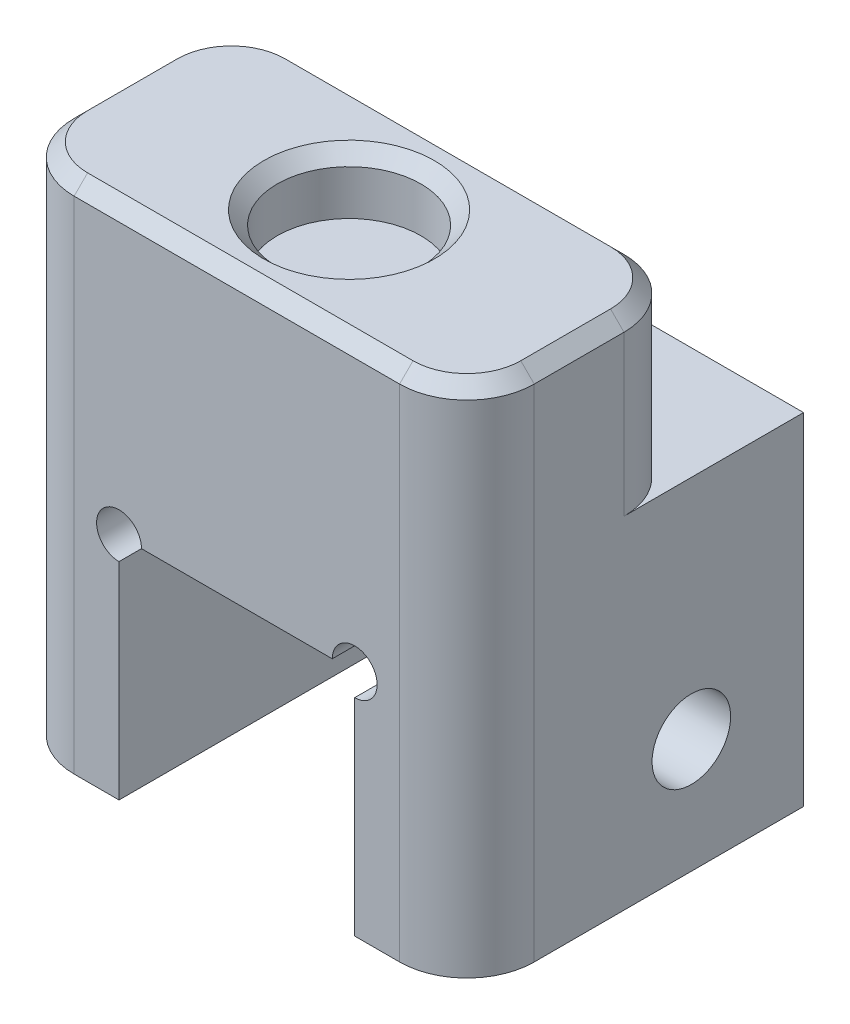
from build123d import *

# Parameters (mm, degrees)
EXTRUDE_1_DEPTH     = 10
EXTRUDE_2_DEPTH     = 5
SKETCH_2_R          = 3.2
CUT_EXTRUDE_1_DEPTH = 2.6
SKETCH_4_R          = 1
CUT_EXTRUDE_3_DEPTH = 22.474752618
SKETCH_6_R          = 1.75
CUT_EXTRUDE_4_DEPTH = 26.521608492
FILLET_1_R          = 3
CHAMFER_1_SIZE      = 0.6


with BuildPart() as part:
    # ｽｹｯﾁ1 → ﾎﾞｽ - 押し出し1 (new body)
    with BuildSketch(Plane.XY):
        Polygon((-10.25, 11.45), (-10.25, -11.45), (-5.25, -11.45), (-5.25, -1.25), (5.25, -1.25), (5.25, -11.45), (10.25, -11.45), (10.25, 11.45), align=None)
    extrude(amount=EXTRUDE_1_DEPTH)

    # ｽｹｯﾁ5 → ﾎﾞｽ - 押し出し2 (add)
    with BuildSketch(Plane(origin=(0, 0, 0), x_dir=(-1, 0, 0), z_dir=(0, 0, -1))):
        Polygon((-10.25, 3.75), (10.25, 3.75), (10.25, -11.45), (5.25, -11.45), (5.25, -1.25), (-5.25, -1.25), (-5.25, -11.45), (-10.25, -11.45), align=None)
    extrude(amount=EXTRUDE_2_DEPTH)

    # ｽｹｯﾁ2 → ｶｯﾄ - 押し出し1 (cut)
    with BuildSketch(Plane(origin=(0, 11.45, 0), x_dir=(1, 0, 0), z_dir=(0, 1, 0))):
        with Locations(Location((0, -5, 0), (0, 0, 180))):
            Circle(SKETCH_2_R)
    extrude(amount=-CUT_EXTRUDE_1_DEPTH, mode=Mode.SUBTRACT)

    # ｽｹｯﾁ4 → ｶｯﾄ - 押し出し3 (cut, through all)
    with BuildSketch(Plane.XY.offset(10)):
        with Locations((5.25, -1.25)):
            Circle(SKETCH_4_R)
        with Locations((-5.25, -1.25)):
            Circle(SKETCH_4_R)
    extrude(amount=-CUT_EXTRUDE_3_DEPTH, mode=Mode.SUBTRACT)

    # ｽｹｯﾁ6 → ｶｯﾄ - 押し出し4 (cut, through all)
    with BuildSketch(Plane(origin=(10.25, 0, 0), x_dir=(0, 0, -1), z_dir=(1, 0, 0))):
        with Locations(Location((0, -6.35, 0), (0, 0, 90))):
            Circle(SKETCH_6_R)
    extrude(amount=-CUT_EXTRUDE_4_DEPTH, mode=Mode.SUBTRACT)

    # ﾌｨﾚｯﾄ1
    fillet_1_edges = [part.edges().sort_by_distance(p)[0] for p in [
        (10.25, 0, 10),
        (-10.25, 7.6, 0),
        (10.25, 7.6, 0),
        (-10.25, 0, 10),
    ]]
    fillet(fillet_1_edges, radius=FILLET_1_R)

    # 面取り1
    chamfer_1_edges = [part.edges().sort_by_distance(p)[0] for p in [
        (3.2, 11.45, 5),
        (0, 11.45, 0),
        (-10.25, 11.45, 5),
        (0, 11.45, 10),
        (10.25, 11.45, 5),
        (9.371320344, 11.45, 9.121320344),
        (9.371320344, 11.45, 0.878679656),
        (-9.371320344, 11.45, 9.121320344),
        (-9.371320344, 11.45, 0.878679656),
    ]]
    chamfer(chamfer_1_edges, length=CHAMFER_1_SIZE)


solid = part.part
